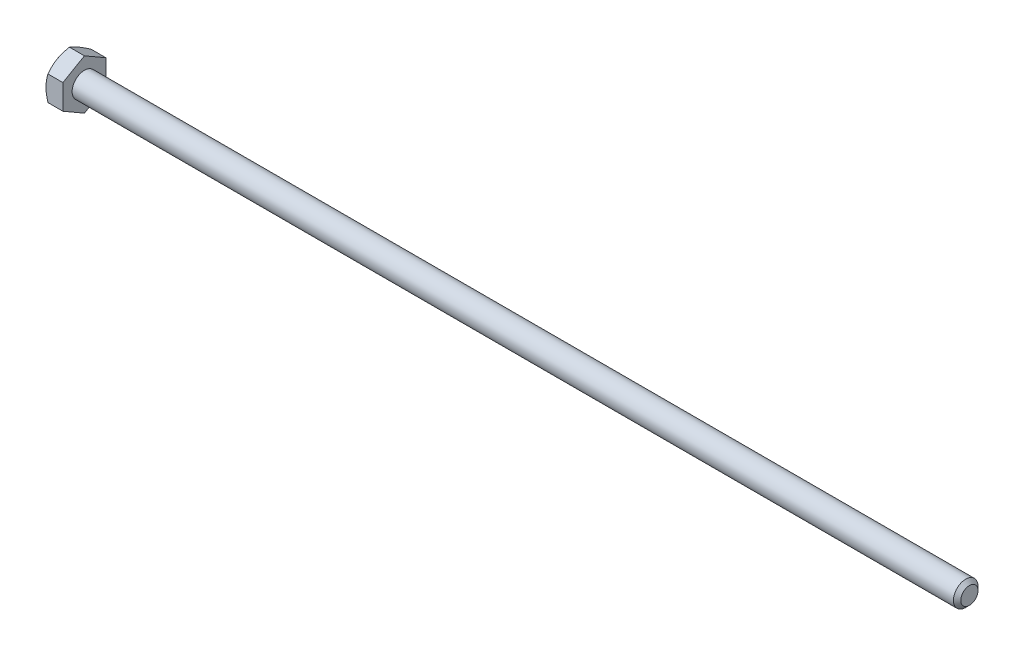
from build123d import *

# Parameters (mm, degrees)
SKETCH5_R           = 3.175
BOSS_EXTRUDE3_DEPTH = 228.6
CHAMFER1_SIZE       = 0.9525
BOSS_EXTRUDE4_DEPTH = 4.365625
SKETCH8_OUTSIDE_W   = 870.844
SKETCH8_OUTSIDE_H   = 872.564
SKETCH8_OUTSIDE_R   = 5.55625
CUT_EXTRUDE3_DEPTH  = 234.120176943
CUT_EXTRUDE3_DRAFT  = -60
CUT_EXTRUDE4_DEPTH  = 0.254
CIRPATTERN1_COUNT   = 6


with BuildPart() as part:
    # Sketch5 → Boss-Extrude3 (new body)
    with BuildSketch(Plane(origin=(116.4828125, 0, 0), x_dir=(0, 0, -1), z_dir=(1, 0, 0))):
        Circle(SKETCH5_R)
    extrude(amount=-BOSS_EXTRUDE3_DEPTH)

    # Chamfer1
    chamfer1_edges = [part.edges().sort_by_distance(p)[0] for p in [
        (116.4828125, 0, 3.175),
    ]]
    chamfer(chamfer1_edges, length=CHAMFER1_SIZE)

    # Sketch11 → Revolve1 (revolve)
    with BuildSketch(Plane.XY):
        Polygon((-112.1171875, 3.175), (-112.1171875, 0), (94.2578125, 0), (91.0828125, 3.175), align=None)
    revolve(axis=Axis((-112.1171875, 0, 0), (1, 0, 0)))

    # Sketch6 → Boss-Extrude4 (add)
    with BuildSketch(Plane.ZY.offset(112.1171875)):
        Polygon((5.55625, 3.207902433), (0, 6.415804866), (-5.55625, 3.207902433), (-5.55625, -3.207902433), (0, -6.415804866), (5.55625, -3.207902433), align=None)
    extrude(amount=BOSS_EXTRUDE4_DEPTH)


with BuildPart() as cut_extrude3_tool:
    # Sketch8 outside → Cut-Extrude3 (with draft: the straight prism first)
    with BuildSketch(Plane.ZY.offset(116.4828125)):
        Rectangle(SKETCH8_OUTSIDE_W, SKETCH8_OUTSIDE_H)
        Circle(SKETCH8_OUTSIDE_R, mode=Mode.SUBTRACT)
    extrude(amount=-CUT_EXTRUDE3_DEPTH)
    # Cut-Extrude3: the draft: its side faces are tilted about the plane it starts from
    cut_extrude3_sides = [cut_extrude3_tool.faces().sort_by_distance(p)[0] for p in [
        (0.577275971, -436.282, 0),
        (0.577275971, 0, 435.422),
        (0.577275971, 436.282, 0),
        (0.577275971, 0, -435.422),
        (0.577275971, 0, -5.55625),
    ]]
    draft(cut_extrude3_sides, Plane.ZY.offset(116.4828125), CUT_EXTRUDE3_DRAFT)


with BuildPart() as part_1:
    add(part.part)

    # Cut-Extrude3: cut by cut_extrude3_tool
    add(cut_extrude3_tool.part, mode=Mode.SUBTRACT)

    # Sketch12 → Cut-Extrude4 (cut)
    with BuildSketch(Plane.ZY.offset(116.4828125)):
        with BuildLine():
            Line((0.1666875, 4.2783125), (0.1666875, 2.3891875))
            ThreePointArc((0.1666875, 2.3891875), (0, 2.2225), (-0.1666875, 2.3891875))
            Line((-0.1666875, 2.3891875), (-0.1666875, 4.2783125))
            ThreePointArc((-0.1666875, 4.2783125), (0, 4.445), (0.1666875, 4.2783125))
        make_face()
    cut_extrude4 = extrude(amount=-CUT_EXTRUDE4_DEPTH, mode=Mode.SUBTRACT)

    # CirPattern1: Cut-Extrude4 ×6 about axis
    cirpattern1_axis = Axis((0, 0, 0), (1, 0, 0))
    for i in range(1, CIRPATTERN1_COUNT):
        add(cut_extrude4.rotate(cirpattern1_axis, i * 360 / CIRPATTERN1_COUNT), mode=Mode.SUBTRACT)


solid = part_1.part
